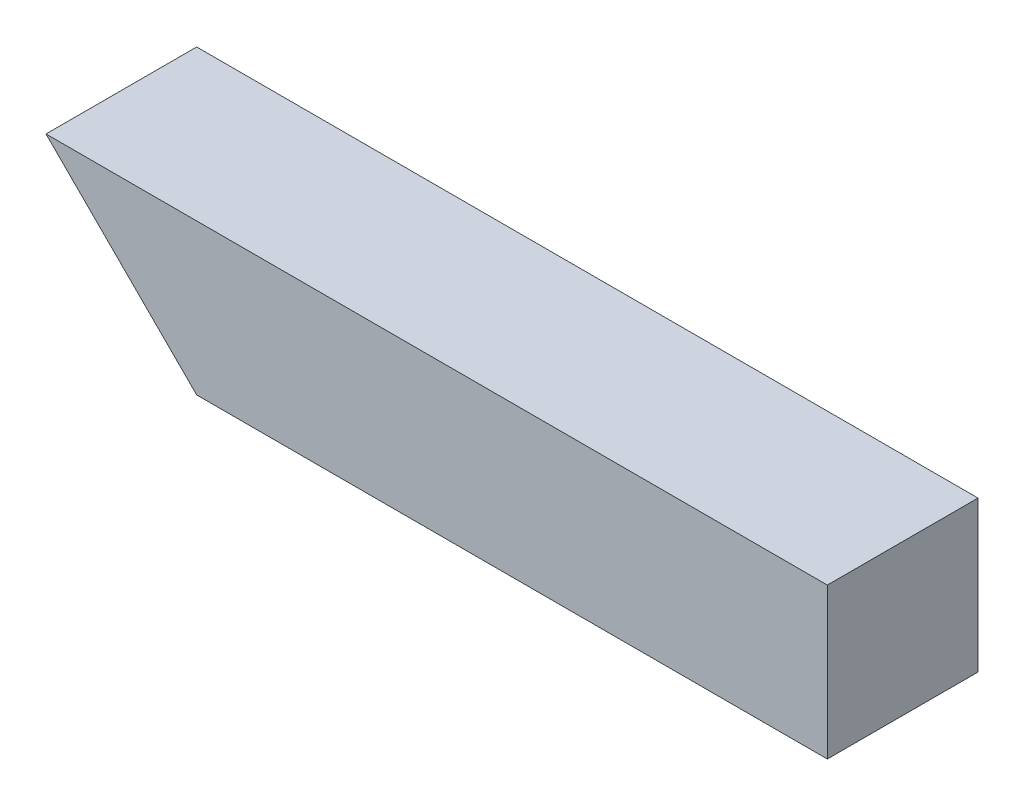
from build123d import *

# Parameters (mm, degrees)
SKETCH1_W               = 38.1
SKETCH1_H               = 38.1
BOSS_EXTRUDE1_DEPTH     = 197.565634586
CUT_EXTRUDE1_DEPTH      = 205.781346732
CUT_EXTRUDE1_DEPTH_BACK = 205.781346732


with BuildPart() as part:
    # Sketch1 → Boss-Extrude1 (new body)
    with BuildSketch(Plane(origin=(0, 0, 0), x_dir=(0, 0, -1), z_dir=(1, 0, 0))):
        with Locations((19.05, -19.05)):
            Rectangle(SKETCH1_W, SKETCH1_H)
    extrude(amount=BOSS_EXTRUDE1_DEPTH)

    # Sketch2 → Cut-Extrude1 (cut, two sides: drawn at the far end of the back side and taken through both)
    with BuildSketch(Plane.XY.offset(-CUT_EXTRUDE1_DEPTH_BACK)):
        Polygon((-412.411679599, -38.1), (0, -38.1), (38.1, -38.1), (0, 0), (-291.619095285, 291.619095285), (-1066.105455758, 575.352158778), (-1186.898040072, 245.633063493), align=None)
    extrude(amount=CUT_EXTRUDE1_DEPTH + CUT_EXTRUDE1_DEPTH_BACK, mode=Mode.SUBTRACT)


solid = part.part
